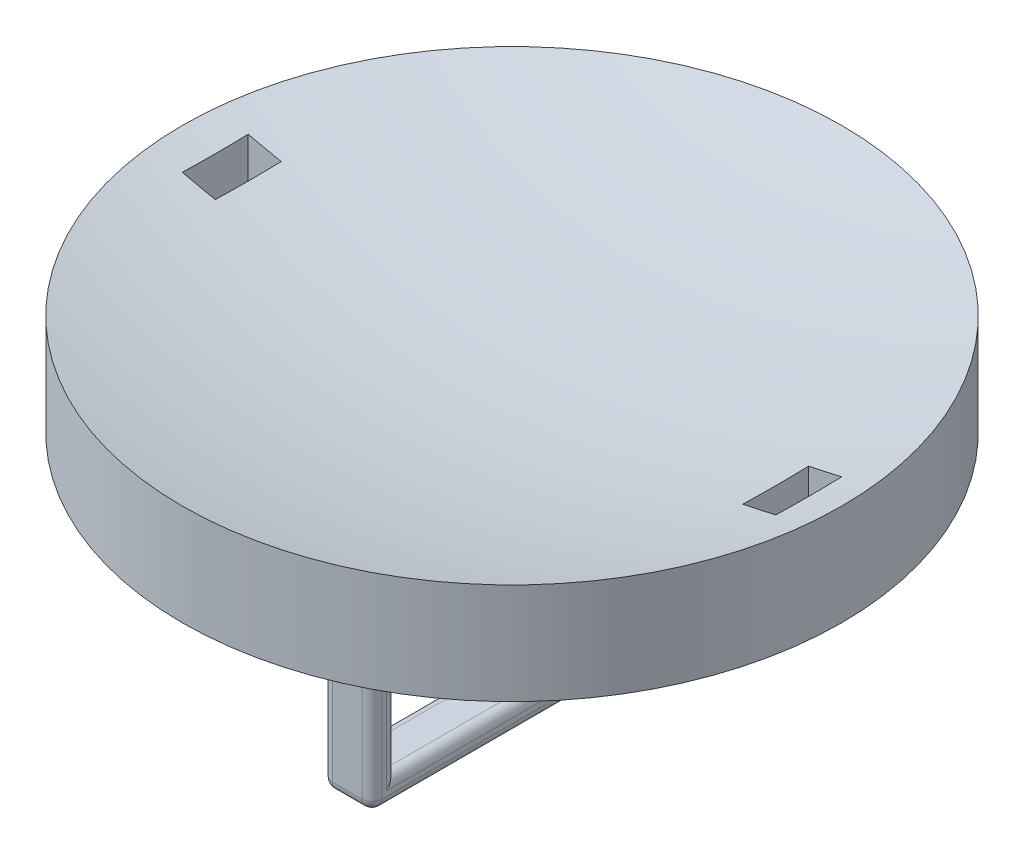
from build123d import *

# Parameters (mm, degrees)
ESQUISSE2_W             = 20
ESQUISSE2_H             = 15
ESQUISSE2_W_2           = 17
ESQUISSE2_H_2           = 12
BOSS_EXTRU_1_DEPTH      = 1.5
CONG_4_R                = 0.6
ESQUISSE4_W             = 2
ESQUISSE4_H             = 4
ENL_V_MAT_EXTRU_1_DEPTH = 16


with BuildPart() as part:
    # Esquisse1 → Révolution3 (revolve)
    with BuildSketch(Plane.XY):
        with BuildLine():
            Line((-20, -3.590766689), (-20, 2.540333076))
            ThreePointArc((-20, 2.540333076), (-10.080343399, 0.637624299), (0, 0))
            Line((0, 0), (0, -5.950080138))
            ThreePointArc((0, -5.950080138), (-10.069339104, -5.358213932), (-20, -3.590766689))
        make_face()
    revolve(axis=Axis((0, 0, 0), (0, 1, 0)))

    # Esquisse2 → Boss.-Extru.1 (add, symmetric)
    with BuildSketch(Plane(origin=(0, 0, 0), x_dir=(0, 0, -1), z_dir=(1, 0, 0))):
        with Locations((0, -10.5)):
            Rectangle(ESQUISSE2_W, ESQUISSE2_H)
        with Locations((0, -10.5)):
            Rectangle(ESQUISSE2_W_2, ESQUISSE2_H_2, mode=Mode.SUBTRACT)
    extrude(amount=BOSS_EXTRU_1_DEPTH, both=True)

    # Congé4
    cong_4_edges = [part.edges().sort_by_distance(p)[0] for p in [
        (0, -5.528745318, 8.5),
        (-1.5, -5.437680105, 9.250356419),
        (1.5, -5.437680105, 9.250356419),
        (0, -5.366365014, 10),
        (0, -5.528745318, -8.5),
        (-1.5, -5.437680105, -9.250356419),
        (1.5, -5.437680105, -9.250356419),
        (0, -5.366365014, -10),
        (1.5, -11.676592752, 10),
        (1.5, -18, 0),
        (1.5, -11.676592752, -10),
        (-1.5, -11.007795417, 8.5),
        (-1.5, -16.5, 0),
        (-1.5, -11.007795417, -8.5),
        (-1.5, -11.676592752, -10),
        (0, -18, -10),
        (-1.5, -11.676592752, 10),
        (-1.5, -18, 0),
        (0, -18, 10),
        (1.5, -11.007795417, -8.5),
        (1.5, -11.007795417, 8.5),
        (1.5, -16.5, 0),
    ]]
    fillet(cong_4_edges, radius=CONG_4_R)

    # Esquisse4 → Enlèv. mat.-Extru.1 (cut, symmetric)
    with BuildSketch(Plane(origin=(0, 0, 0), x_dir=(1, 0, 0), z_dir=(0, 1, 0))):
        with Locations((-17, 0)):
            Rectangle(ESQUISSE4_W, ESQUISSE4_H)
        with Locations((17, 0)):
            Rectangle(ESQUISSE4_W, ESQUISSE4_H)
    extrude(amount=ENL_V_MAT_EXTRU_1_DEPTH, both=True, mode=Mode.SUBTRACT)


solid = part.part
